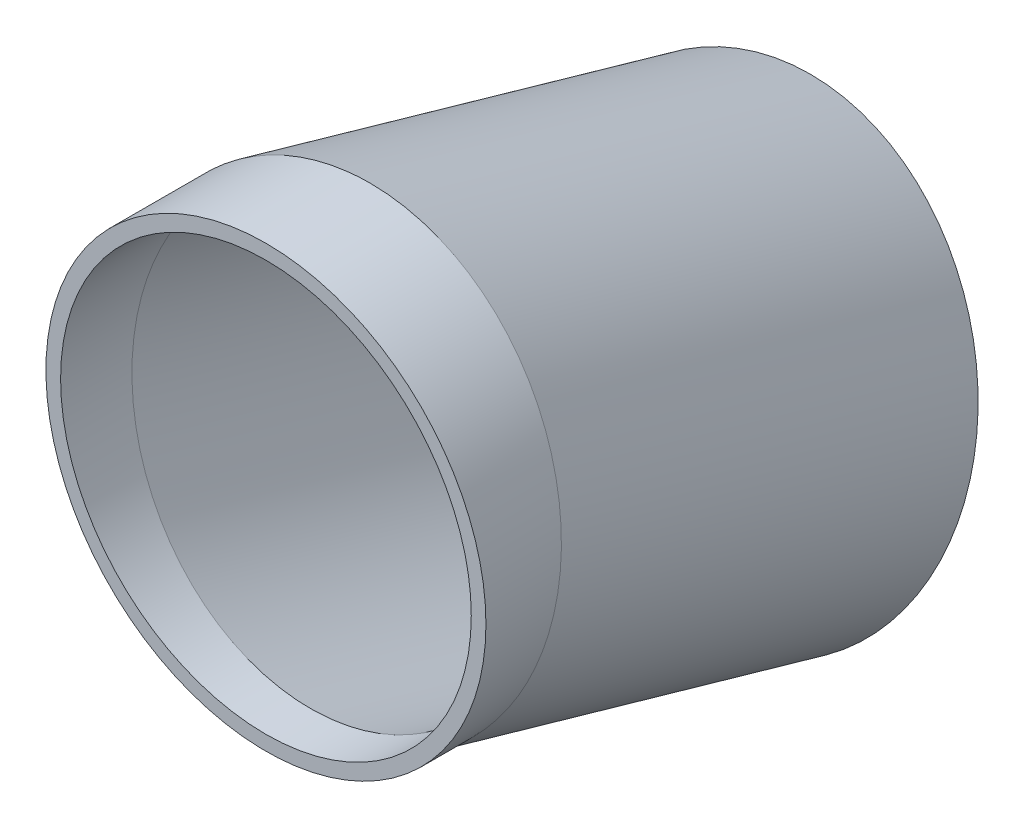
from build123d import *

# Parameters (mm, degrees)
SKETCH1_R   = 75
SKETCH1_R_2 = 70


with BuildPart() as part:
    # Sweep1: sweep along a path in Sketch2
    with BuildLine(Plane(origin=(0, 0, 0), x_dir=(0, 0, -1), z_dir=(1, 0, 0))) as sweep1_path:
        Line((0, 0), (25, 0))
        Line((25, 0), (165, -40))
    # Sketch1 → Sweep1 (sweep)
    with BuildSketch(Plane.XY):
        Circle(SKETCH1_R)
        Circle(SKETCH1_R_2, mode=Mode.SUBTRACT)
    sweep(path=sweep1_path.line, transition=Transition.RIGHT)


solid = part.part
